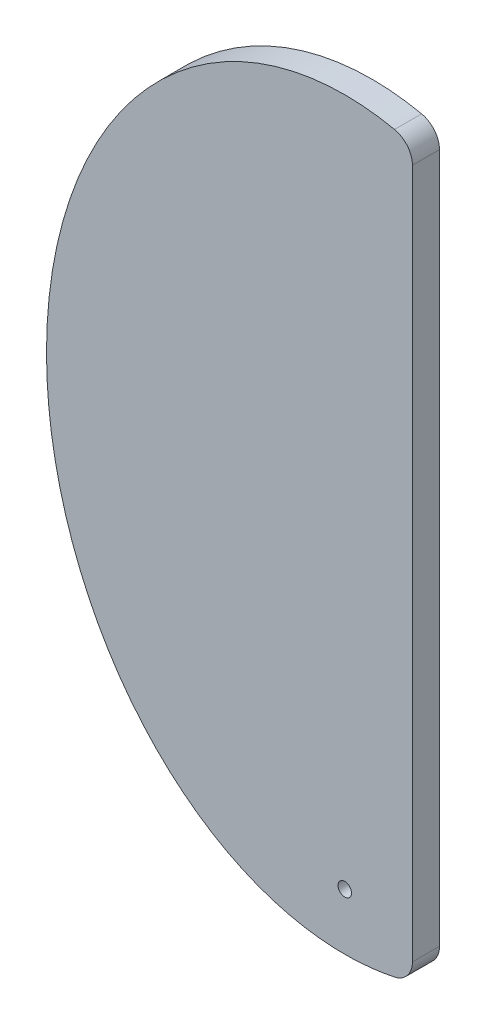
from build123d import *

# Parameters (mm, degrees)
SKETCH1_RX          = 82.5
SKETCH1_RY          = 66.100974472
SKETCH1_R           = 1.5
BOSS_EXTRUDE1_DEPTH = 6
CUT_EXTRUDE1_DEPTH  = 10
FILLET1_R           = 5


with BuildPart() as part:
    # Sketch1 → Boss-Extrude1 (new body)
    with BuildSketch(Plane.XY):
        with Locations(Location((0, 0), (0, 0, -90))):
            Ellipse(SKETCH1_RX, SKETCH1_RY)
        with Locations((0, -70)):
            Circle(SKETCH1_R, mode=Mode.SUBTRACT)
    extrude(amount=BOSS_EXTRUDE1_DEPTH)

    # Sketch2 → Cut-Extrude1 (cut)
    with BuildSketch(Plane.XY.offset(6)):
        Polygon((15, -139.275656824), (15, 151.801672259), (87.864363855, 144.832157463), (90.234186387, -139.275656824), align=None)
    extrude(amount=-CUT_EXTRUDE1_DEPTH, mode=Mode.SUBTRACT)

    # Fillet1
    fillet1_edges = [part.edges().sort_by_distance(p)[0] for p in [
        (15, -80.347748934, 3),
        (15, 80.347748934, 3),
    ]]
    fillet(fillet1_edges, radius=FILLET1_R)


solid = part.part
